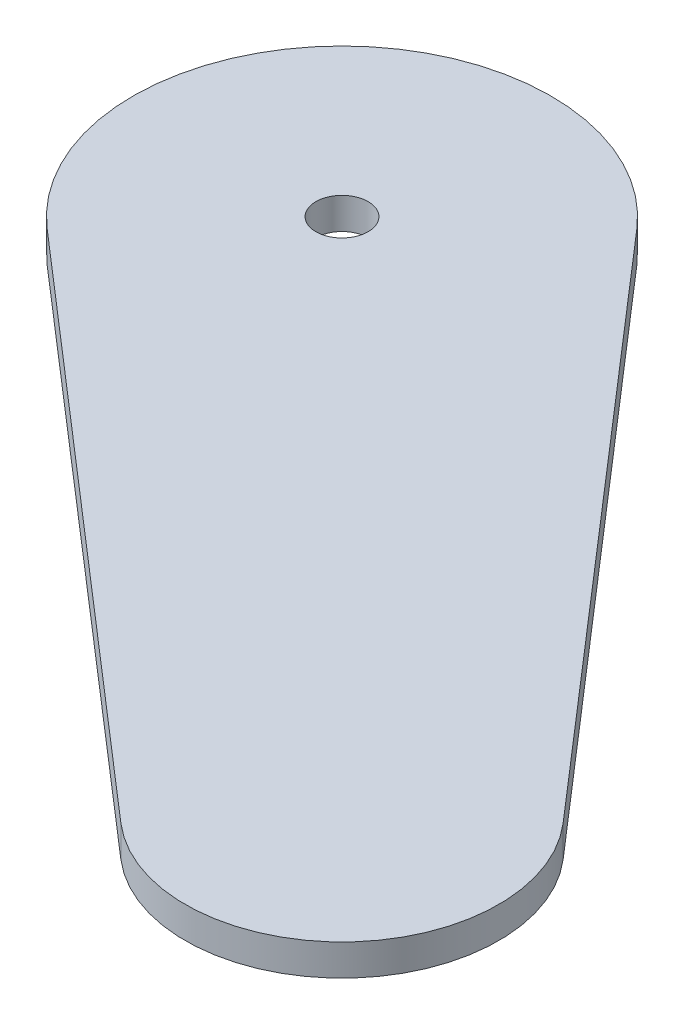
from build123d import *

# Parameters (mm, degrees)
SKETCH_1_R          = 20
SKETCH_1_R_2        = 15
EXTRUDE_1_DEPTH     = 3
SKETCH_2_R          = 2.5
CUT_EXTRUDE_1_DEPTH = 92.262525064


with BuildPart() as part:
    # 草图1 → 凸台-拉伸1 (new body)
    with BuildSketch(Plane(origin=(0, 0, 0), x_dir=(1, 0, 0), z_dir=(0, 1, 0))):
        Circle(SKETCH_1_R)
        with BuildLine():
            ThreePointArc((20, 0), (8.309115435, -18.192267607), (-13.095860068, -15.116165158))
            Line((-13.095860068, -15.116165158), (39.675579632, -60.834598551))
            ThreePointArc((39.675579632, -60.834598551), (38.890872965, -38.890872965), (60.834598551, -39.675579632))
            Line((60.834598551, -39.675579632), (15.116165158, 13.095860068))
            ThreePointArc((15.116165158, 13.095860068), (18.73930766, 6.98844392), (20, 0))
        make_face()
        with Locations((49.497474683, -49.497474683)):
            Circle(SKETCH_1_R_2)
    extrude(amount=EXTRUDE_1_DEPTH)

    # 草图2 → 切除-拉伸1 (cut, through all)
    with BuildSketch(Plane(origin=(0, 3, 0), x_dir=(1, 0, 0), z_dir=(0, 1, 0))):
        with Locations(Location((0, 0, 0), (0, 0, 270))):
            Circle(SKETCH_2_R)
    extrude(amount=-CUT_EXTRUDE_1_DEPTH, mode=Mode.SUBTRACT)


solid = part.part
